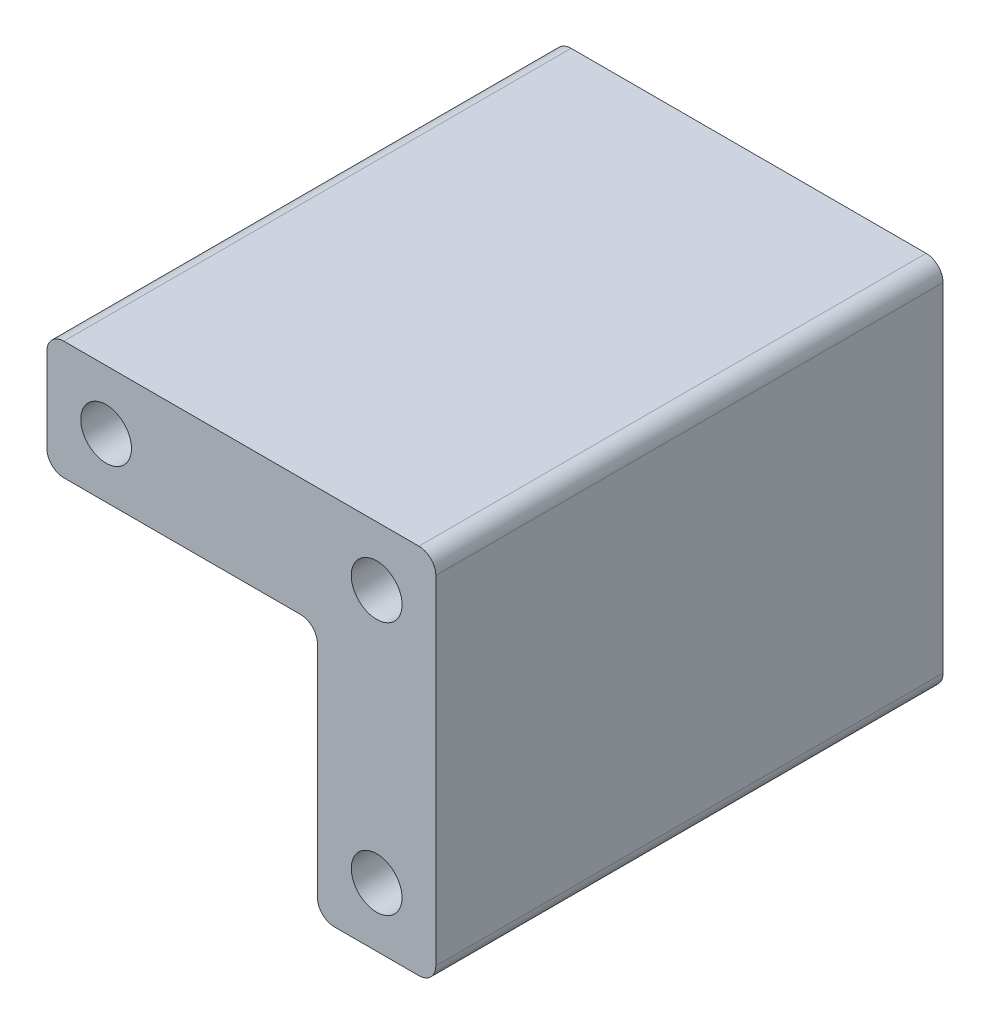
from build123d import *

# Parameters (mm, degrees)
SKETCH_1_W          = 23
SKETCH_1_H          = 22
SKETCH_1_R          = 1.5
EXTRUDE_1_DEPTH     = 30
SKETCH_2_W          = 16
SKETCH_2_H          = 15
CUT_EXTRUDE_1_DEPTH = 34.959534744
FILLET_1_R          = 1


with BuildPart() as part:
    # 草图1 → 凸台-拉伸1 (new body)
    with BuildSketch(Plane.XY):
        Rectangle(SKETCH_1_W, SKETCH_1_H)
        with Locations((-8, 7.5)):
            Circle(SKETCH_1_R, mode=Mode.SUBTRACT)
        with Locations((8, 7.5)):
            Circle(SKETCH_1_R, mode=Mode.SUBTRACT)
        with Locations((-8, -7.5)):
            Circle(SKETCH_1_R, mode=Mode.SUBTRACT)
        with Locations((8, -7.5)):
            Circle(SKETCH_1_R, mode=Mode.SUBTRACT)
    extrude(amount=EXTRUDE_1_DEPTH)

    # 草图2 → 切除-拉伸1 (cut, through all)
    with BuildSketch(Plane.XY.offset(30)):
        with Locations((-3.5, -3.5)):
            Rectangle(SKETCH_2_W, SKETCH_2_H)
    extrude(amount=-CUT_EXTRUDE_1_DEPTH, mode=Mode.SUBTRACT)

    # 圆角1
    fillet_1_edges = [part.edges().sort_by_distance(p)[0] for p in [
        (-11.5, 4, 15),
        (4.5, 4, 15),
        (4.5, -11, 15),
        (11.5, -11, 15),
        (-11.5, 11, 15),
        (11.5, 11, 15),
    ]]
    fillet(fillet_1_edges, radius=FILLET_1_R)


solid = part.part
